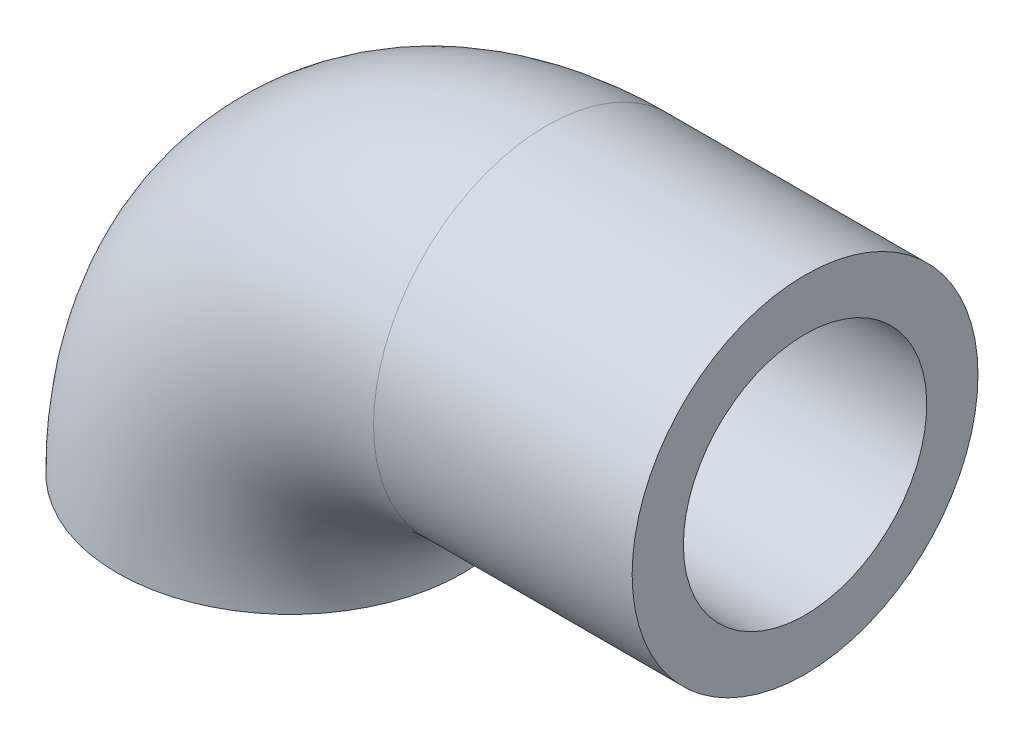
from build123d import *

# Parameters (mm, degrees)
SKETCH2_R   = 6.75
SKETCH2_R_2 = 4.75


with BuildPart() as part:
    # Sweep1: sweep along a path in Sketch1
    with BuildLine(Plane.XY) as sweep1_path:
        Line((20.094853238, 10), (10, 10))
        ThreePointArc((10, 10), (2.928932188, 7.071067812), (0, 0))
    # Sketch2 → Sweep1 (sweep)
    with BuildSketch(Plane(origin=(0, 0, 0), x_dir=(1, 0, 0), z_dir=(0, 1, 0))):
        Circle(SKETCH2_R)
        Circle(SKETCH2_R_2, mode=Mode.SUBTRACT)
    sweep(path=sweep1_path.line)


solid = part.part
